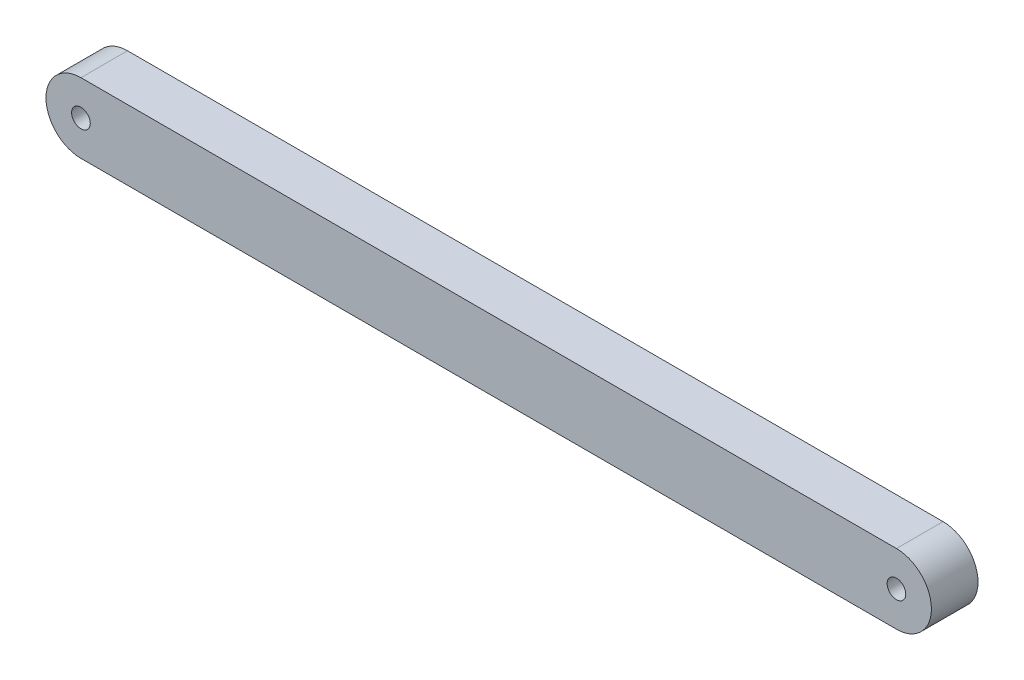
from build123d import *

# Parameters (mm, degrees)
EXTRUDE_1_DEPTH     = 20
SKETCH_2_R          = 4
CUT_EXTRUDE_1_DEPTH = 20


with BuildPart() as part:
    # 草图1 → 凸台-拉伸1 (new body)
    with BuildSketch(Plane.XY):
        with BuildLine():
            Line((0, -15), (350, -15))
            ThreePointArc((350, -15), (365, 0), (350, 15))
            Line((350, 15), (0, 15))
            ThreePointArc((0, 15), (-15, 0), (0, -15))
        make_face()
    extrude(amount=EXTRUDE_1_DEPTH)

    # 草图2 → 切除-拉伸1 (cut)
    with BuildSketch(Plane.XY):
        Circle(SKETCH_2_R)
        with Locations((350, 0)):
            Circle(SKETCH_2_R)
    extrude(amount=CUT_EXTRUDE_1_DEPTH, mode=Mode.SUBTRACT)


solid = part.part
